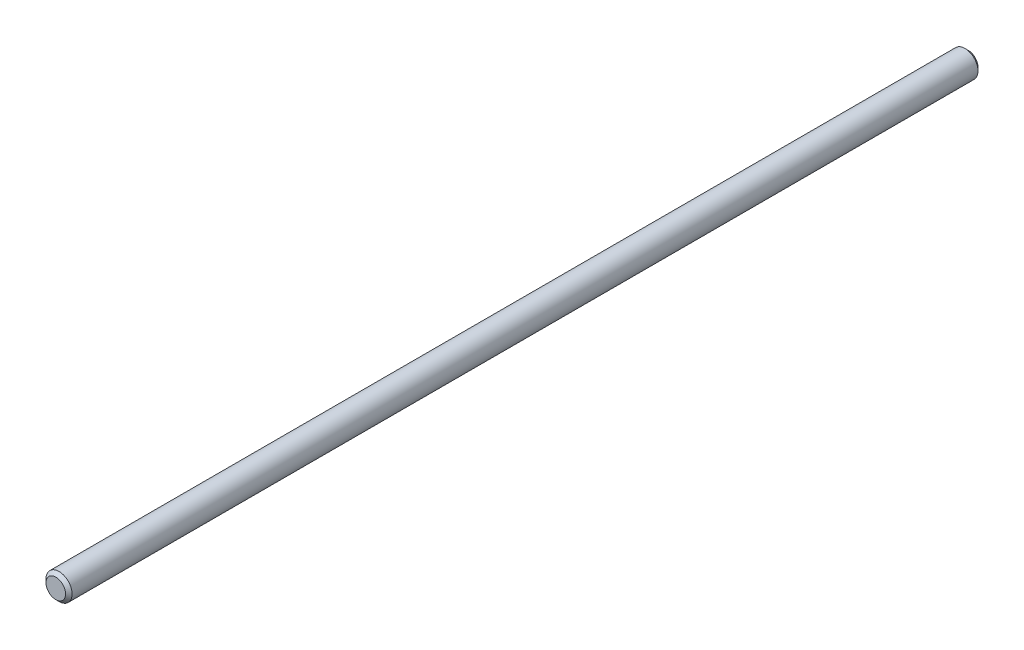
from build123d import *

# Parameters (mm, degrees)
SKETCH1_R           = 4
BOSS_EXTRUDE1_DEPTH = 280
CHAMFER1_SIZE       = 1


with BuildPart() as part:
    # Sketch1 → Boss-Extrude1 (new body)
    with BuildSketch(Plane.XY):
        Circle(SKETCH1_R)
    extrude(amount=BOSS_EXTRUDE1_DEPTH)

    # Chamfer1
    chamfer1_edges = [part.edges().sort_by_distance(p)[0] for p in [
        (-4, 0, 0),
        (-4, 0, 280),
    ]]
    chamfer(chamfer1_edges, length=CHAMFER1_SIZE)


solid = part.part
